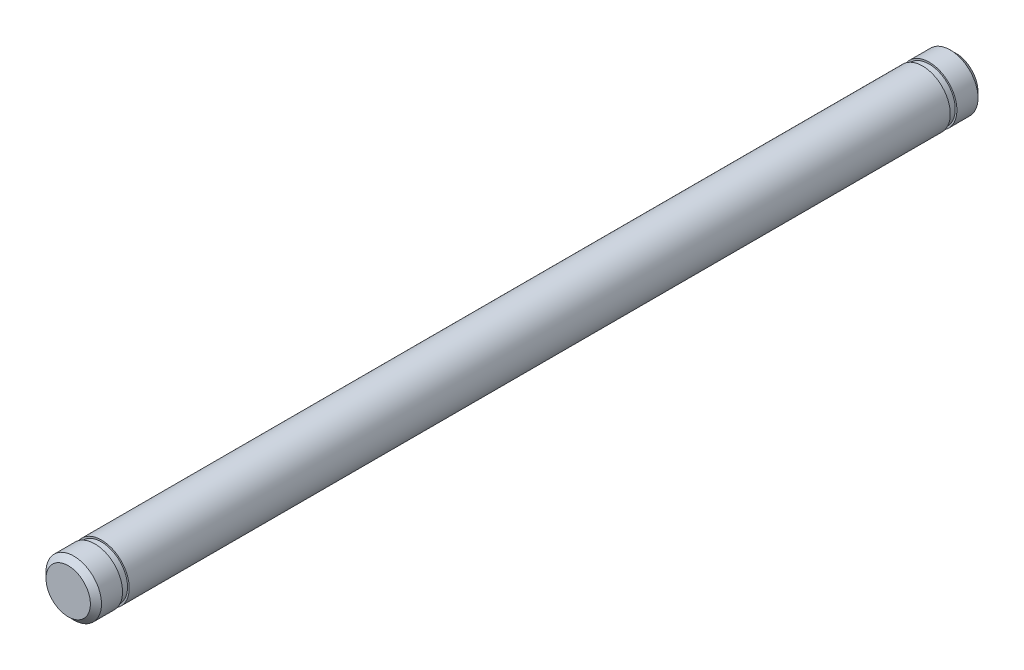
from build123d import *

# Parameters (mm, degrees)
SKETCH_1_R          = 2.5
EXTRUDE_1_DEPTH     = 80
CHAMFER_1_SIZE      = 0.5
CUT_EXTRUDE_START   = -2.4
SKETCH_2_R          = 2.5
SKETCH_2_R_2        = 2.35
CUT_EXTRUDE_1_DEPTH = 0.6


with BuildPart() as part:
    # 草图1 → 凸台-拉伸1 (new body)
    with BuildSketch(Plane.XY):
        Circle(SKETCH_1_R)
    extrude(amount=EXTRUDE_1_DEPTH)

    # 倒角1
    chamfer_1_edges = [part.edges().sort_by_distance(p)[0] for p in [
        (-2.5, 0, 0),
        (-2.5, 0, 80),
    ]]
    chamfer(chamfer_1_edges, length=CHAMFER_1_SIZE)

    # 草图2 → 切除-拉伸1 (cut)
    with BuildSketch(Plane(origin=(0, 0, 0), x_dir=(-1, 0, 0), z_dir=(0, 0, -1)).offset(CUT_EXTRUDE_START)):
        Circle(SKETCH_2_R)
        Circle(SKETCH_2_R_2, mode=Mode.SUBTRACT)
    cut_extrude_1 = extrude(amount=-CUT_EXTRUDE_1_DEPTH, mode=Mode.SUBTRACT)

    # 镜向1: 切除-拉伸1 across plane
    add(cut_extrude_1.mirror(Plane.XY.offset(40)), mode=Mode.SUBTRACT)


solid = part.part
